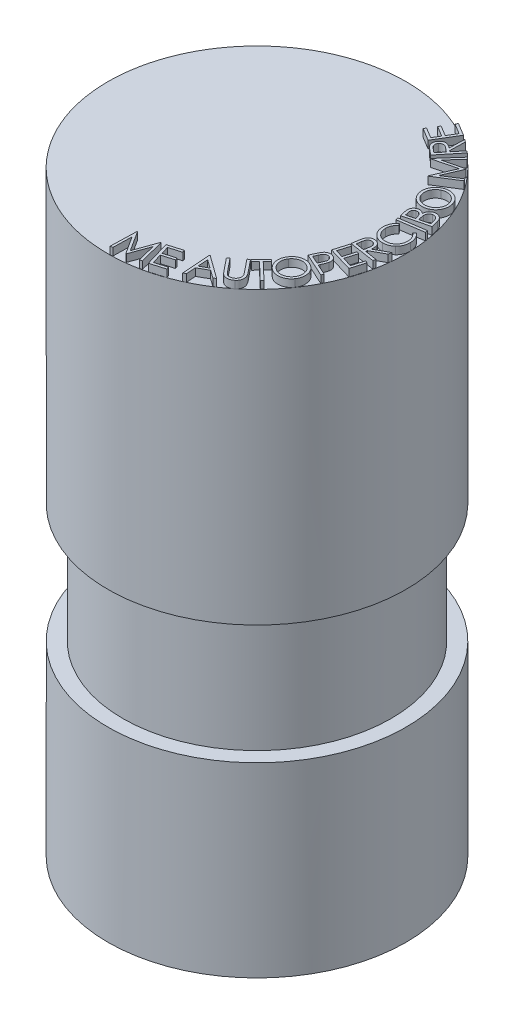
from build123d import *

# Parameters (mm, degrees)
CROQUIS1_R              = 20
SALIENTE_EXTRUIR1_DEPTH = 80
CROQUIS2_W              = 2
CROQUIS2_H              = 16
SALIENTE_EXTRUIR2_DEPTH = 1


with BuildPart() as part:
    # Croquis1 → Saliente-Extruir1 (new body)
    with BuildSketch(Plane(origin=(0, 0, 0), x_dir=(1, 0, 0), z_dir=(0, 1, 0))):
        with Locations(Location((0, 0, 0), (0, 0, 270))):
            Circle(CROQUIS1_R)
    extrude(amount=SALIENTE_EXTRUIR1_DEPTH)

    # Croquis2 → Cortar-Revolución1 (revolve, cut)
    with BuildSketch(Plane(origin=(0, 0, 0), x_dir=(0, 0, -1), z_dir=(1, 0, 0))):
        with Locations((19, 33)):
            Rectangle(CROQUIS2_W, CROQUIS2_H)
    revolve(axis=Axis((0, -3.31019037, 0), (0, 1, 0)), mode=Mode.SUBTRACT)

    # Croquis3 → Saliente-Extruir2 (add)
    # profile 1 of 16: a face of its own
    with BuildSketch(Plane(origin=(0, 80, 0), x_dir=(1, 0, 0), z_dir=(0, 1, 0))):
        Polygon((0.262920673, -19.970552885), (0.365284455, -16.467047276), (0.422075321, -16.460737179), (2.141225962, -19.13271234), (3.211838942, -16.147335737), (3.267928686, -16.141726763), (4.149238782, -19.534455128), (3.809895833, -19.573016827), (3.195713141, -17.144330929), (2.252704327, -19.747596154), (2.166466346, -19.757411859), (0.652043269, -17.410757212), (0.595252404, -19.933393429), align=None)
    # profile 2 of 16: a face of its own
    with BuildSketch(Plane(origin=(0, 80, 0), x_dir=(1, 0, 0), z_dir=(0, 1, 0))):
        Polygon((3.827170639, -16.036394888), (5.748244357, -15.4705896), (5.845700286, -15.800817965), (4.259762786, -16.26776508), (4.568256376, -17.315942164), (6.14017144, -16.853201779), (6.236926248, -17.181326779), (4.665011183, -17.644067164), (5.052030414, -18.959371651), (6.623945478, -18.496631266), (6.721401408, -18.826859632), (4.814350126, -19.388458189), align=None)
    # profile 3 of 16: a face of its own
    with BuildSketch(Plane(origin=(0, 80, 0), x_dir=(1, 0, 0), z_dir=(0, 1, 0))):
        Polygon((8.05795711, -14.338696455), (11.163926661, -16.578780589), (10.838606148, -16.760371134), (9.805853744, -16.029101102), (8.499663841, -16.759670012), (8.583798456, -18.020988121), (8.245857751, -18.210291006), (7.984339321, -14.380062641), align=None)
        Polygon((8.379772014, -15.001957673), (8.472320091, -16.390879948), (9.508578103, -15.811753346), align=None, mode=Mode.SUBTRACT)
    # profile 4 of 16: a face of its own
    with BuildSketch(Plane(origin=(0, 80, 0), x_dir=(1, 0, 0), z_dir=(0, 1, 0))):
        with BuildLine():
            Line((9.42995308, -13.537753655), (9.700586092, -13.319704777))
            Line((9.700586092, -13.319704777), (11.019396189, -14.954019681))
            add(Edge.make_bspline(
                [(11.019396189, -14.954019681), (11.038159707, -14.976868058), (11.073902476, -15.020392105), (11.123762411, -15.083221771), (11.170337216, -15.13751021), (11.210924398, -15.185252117), (11.246010621, -15.226094636), (11.275827607, -15.259841043), (11.301335022, -15.286034267), (11.316870923, -15.300876915), (11.323683048, -15.307385065)],
                knots=[0, 0, 0, 0, 1.520764006, 2.89691493, 4.125196125, 5.199597565, 6.120141528, 6.894832544, 7.515410236, 8, 8, 8, 8], degree=3))
            add(Edge.make_bspline(
                [(11.323683048, -15.307385065), (11.348145641, -15.330022997), (11.395572374, -15.373912175), (11.47360989, -15.426858554), (11.551665552, -15.469926532), (11.632461, -15.50088692), (11.717494301, -15.519580087), (11.808202244, -15.524508735), (11.904960273, -15.517984613), (12.005729612, -15.498856411), (12.10630543, -15.469346372), (12.2020613, -15.430114767), (12.290967908, -15.381625007), (12.344473927, -15.341913808), (12.371159009, -15.322108623)],
                knots=[0, 0, 0, 0, 1.040137847, 2.016562117, 2.938047741, 3.821020636, 4.710583084, 5.647195567, 6.649867989, 7.734190427, 8.845716221, 9.919833567, 10.962557647, 12, 12, 12, 12], degree=3))
            add(Edge.make_bspline(
                [(12.371159009, -15.322108623), (12.392580067, -15.303353448), (12.435304089, -15.265946495), (12.492428473, -15.20254751), (12.541542072, -15.132589626), (12.583500775, -15.057612739), (12.617878792, -14.979088783), (12.642504889, -14.89813592), (12.657604376, -14.815794364), (12.662144982, -14.732014213), (12.658151214, -14.646869971), (12.643737994, -14.560873308), (12.620031394, -14.4740373), (12.596836743, -14.417675418), (12.585001157, -14.388915514)],
                knots=[0, 0, 0, 0, 0.992167313, 1.978864769, 2.966907326, 3.966575884, 4.970255265, 5.949826752, 6.910471341, 7.881873917, 8.869109633, 9.876553196, 10.916464007, 12, 12, 12, 12], degree=3))
            add(Edge.make_bspline(
                [(12.585001157, -14.388915514), (12.579576344, -14.377365952), (12.5674671, -14.351585066), (12.543058691, -14.31164806), (12.5136777, -14.264773571), (12.476760164, -14.212789316), (12.435152023, -14.15344533), (12.385471174, -14.089489391), (12.331031305, -14.018118888), (12.291591925, -13.969311683), (12.270898592, -13.943703174)],
                knots=[0, 0, 0, 0, 0.560616297, 1.251405465, 2.055212887, 2.992931923, 4.053585124, 5.241388444, 6.552592194, 8, 8, 8, 8], degree=3))
            Line((12.270898592, -13.943703174), (10.952088496, -12.30938827))
            Line((10.952088496, -12.30938827), (11.222721509, -12.091339392))
            Line((11.222721509, -12.091339392), (12.541531605, -13.725654296))
            add(Edge.make_bspline(
                [(12.541531605, -13.725654296), (12.565035468, -13.755230662), (12.611077029, -13.813167609), (12.676175615, -13.89966472), (12.735256924, -13.984129862), (12.788684266, -14.065778258), (12.835439373, -14.145475432), (12.878176413, -14.221604179), (12.913673412, -14.296065495), (12.944395839, -14.368152497), (12.969729102, -14.439809045), (12.98764187, -14.512912479), (13.000365668, -14.587650371), (13.007564033, -14.66429813), (13.007879188, -14.742819455), (13.003244852, -14.822994707), (12.991509349, -14.904659411), (12.975091255, -14.987461368), (12.952288697, -15.069961793), (12.921931476, -15.15016344), (12.884869225, -15.227498098), (12.840007295, -15.301532657), (12.789129133, -15.373189274), (12.730292485, -15.441038038), (12.665797021, -15.507123636), (12.617859838, -15.547110327), (12.593414618, -15.567501251)],
                knots=[0, 0, 0, 0, 1.29683383, 2.540359156, 3.715520012, 4.834829386, 5.888774922, 6.886986131, 7.830707756, 8.718771528, 9.576342449, 10.436386598, 11.298971503, 12.17712305, 13.075706197, 13.992021582, 14.931470865, 15.90540027, 16.888407425, 17.865899033, 18.845495464, 19.82788039, 20.834183252, 21.858395803, 22.907904428, 24, 24, 24, 24], degree=3))
            add(Edge.make_bspline(
                [(12.593414618, -15.567501251), (12.566386086, -15.588736984), (12.513196575, -15.630526831), (12.428971058, -15.684937599), (12.344579498, -15.733610082), (12.258814361, -15.7745233), (12.17187381, -15.807385351), (12.084459266, -15.834486678), (11.99548363, -15.853233045), (11.906196421, -15.865445996), (11.817544039, -15.869119491), (11.730759792, -15.867678511), (11.646327168, -15.857543634), (11.563977352, -15.840771572), (11.483739774, -15.816812531), (11.405830234, -15.785925167), (11.330188487, -15.748003647), (11.282530393, -15.717507278), (11.258478721, -15.702116636)],
                knots=[0, 0, 0, 0, 1.144700711, 2.252659125, 3.337304626, 4.389199177, 5.41453013, 6.431875958, 7.43529886, 8.440774248, 9.430813523, 10.388887005, 11.329652752, 12.259690246, 13.186036776, 14.115813444, 15.049105103, 16, 16, 16, 16], degree=3))
            add(Edge.make_bspline(
                [(11.258478721, -15.702116636), (11.242950346, -15.690803387), (11.209305561, -15.666291368), (11.157304993, -15.623537749), (11.101583066, -15.570165997), (11.039852371, -15.508908952), (10.97411828, -15.437644107), (10.903126286, -15.357410217), (10.827097691, -15.268164165), (10.775517272, -15.204888716), (10.748763176, -15.172068559)],
                knots=[0, 0, 0, 0, 0.625227113, 1.354657644, 2.188729345, 3.135311938, 4.184757943, 5.343206505, 6.621955598, 8, 8, 8, 8], degree=3))
            Line((10.748763176, -15.172068559), (9.42995308, -13.537753655))
        make_face()
    # profile 5 of 16: a face of its own
    with BuildSketch(Plane(origin=(0, 80, 0), x_dir=(1, 0, 0), z_dir=(0, 1, 0))):
        Polygon((11.536868452, -12.303090141), (11.292176946, -12.070317705), (12.606780311, -10.690510013), (12.851471818, -10.923282448), (12.31721701, -11.484179884), (14.58674826, -13.645738378), (14.342056754, -13.902348955), (12.072525504, -11.740790461), align=None)
    # profile 6 of 16: a face of its own
    with BuildSketch(Plane(origin=(0, 80, 0), x_dir=(1, 0, 0), z_dir=(0, 1, 0))):
        with BuildLine():
            add(Edge.make_bspline(
                [(13.419185249, -9.282370366), (13.456923299, -9.229876733), (13.531095506, -9.126703182), (13.658850909, -8.988655319), (13.793737653, -8.864914298), (13.937826486, -8.756949618), (14.091699683, -8.666010529), (14.254515263, -8.591706777), (14.425991079, -8.5321625), (14.604871874, -8.490293047), (14.786462702, -8.464140523), (14.967110246, -8.456121454), (15.144428264, -8.466887398), (15.318746284, -8.494531925), (15.489341032, -8.542359886), (15.656766252, -8.607475408), (15.822194144, -8.689019429), (15.926139648, -8.757482599), (15.978980923, -8.792286231)],
                knots=[0, 0, 0, 0, 1.066033823, 2.095235003, 3.097192567, 4.0837777, 5.060749282, 6.041004147, 7.0326349, 8.051383895, 9.06808662, 10.056351471, 11.029998143, 11.995051255, 12.963520223, 13.947644644, 14.956673755, 16, 16, 16, 16], degree=3))
            add(Edge.make_bspline(
                [(15.978980923, -8.792286231), (16.029780586, -8.829164558), (16.129609434, -8.90163592), (16.264050925, -9.025899378), (16.383925636, -9.158270684), (16.487874866, -9.301279643), (16.576276142, -9.453812631), (16.649914434, -9.615938164), (16.706174891, -9.788021253), (16.748209092, -9.966954546), (16.773099239, -10.148890559), (16.781435518, -10.329678285), (16.770719651, -10.506804017), (16.742715879, -10.680741421), (16.695978933, -10.850979584), (16.631763822, -11.017984787), (16.549667464, -11.181591561), (16.482247574, -11.284918859), (16.448031403, -11.337358346)],
                knots=[0, 0, 0, 0, 1.044747507, 2.053083263, 3.042573079, 4.0150113, 4.991740329, 5.974276943, 6.975003363, 8.002267044, 9.031674491, 10.029064489, 11.011701332, 11.98182306, 12.958203001, 13.946382756, 14.957771684, 16, 16, 16, 16], degree=3))
            add(Edge.make_bspline(
                [(16.448031403, -11.337358346), (16.410652834, -11.388600428), (16.337079997, -11.489461039), (16.21185145, -11.625648652), (16.078536548, -11.747485913), (15.934292257, -11.851992364), (15.782066625, -11.942754912), (15.619124052, -12.01550818), (15.447709191, -12.074142098), (15.268630298, -12.115472837), (15.087236916, -12.140690257), (14.907146728, -12.148723508), (14.730757329, -12.138918909), (14.557894921, -12.111852041), (14.389307957, -12.065260836), (14.223902351, -12.003009549), (14.062249795, -11.922038144), (13.960311115, -11.855571287), (13.908568262, -11.821833507)],
                knots=[0, 0, 0, 0, 1.056740191, 2.079998671, 3.078619863, 4.062946356, 5.044616301, 6.028163563, 7.032401823, 8.06072216, 9.087328406, 10.081851471, 11.06138479, 12.028038447, 12.993120206, 13.972258204, 14.970742556, 16, 16, 16, 16], degree=3))
            add(Edge.make_bspline(
                [(13.908568262, -11.821833507), (13.874810711, -11.79773569), (13.807822048, -11.749915853), (13.713933671, -11.670881667), (13.625693541, -11.587449267), (13.544718841, -11.497990419), (13.468546102, -11.404787847), (13.398817704, -11.306253662), (13.336029964, -11.202466355), (13.279127059, -11.09463538), (13.229682567, -10.983548454), (13.187224663, -10.870608298), (13.153805274, -10.756132899), (13.127596051, -10.640720851), (13.109435598, -10.524062396), (13.098656998, -10.406031554), (13.096849474, -10.28678247), (13.102397211, -10.167119498), (13.11560468, -10.048116597), (13.136787604, -9.931081735), (13.164780846, -9.816242106), (13.200506658, -9.703982057), (13.244217601, -9.594509065), (13.294906749, -9.487436962), (13.352876463, -9.382880724), (13.39700922, -9.315984624), (13.419185249, -9.282370366)],
                knots=[0, 0, 0, 0, 1.037498041, 2.058816626, 3.068109967, 4.073992118, 5.075922538, 6.078671835, 7.091651888, 8.10922995, 9.127563933, 10.132357503, 11.126062036, 12.109248317, 13.091860485, 14.078241757, 15.072565591, 16.073676463, 17.074035494, 18.066293485, 19.047808686, 20.02988123, 21.011588053, 21.995174276, 22.992605997, 24, 24, 24, 24], degree=3))
        make_face()
        with BuildLine():
            add(Edge.make_bspline(
                [(13.708748551, -9.462558667), (13.691086724, -9.48920686), (13.655850172, -9.542371825), (13.609776074, -9.625845983), (13.56966968, -9.711877072), (13.535036595, -9.800274979), (13.507279398, -9.891581008), (13.484694781, -9.985209655), (13.467815279, -10.081188632), (13.457339819, -10.179106501), (13.453451737, -10.277453825), (13.454349381, -10.375361188), (13.462928883, -10.471873937), (13.477869921, -10.566875968), (13.498070129, -10.660397772), (13.524755221, -10.752793361), (13.558597444, -10.843452885), (13.59773897, -10.932868991), (13.643163765, -11.019187967), (13.693806674, -11.102444335), (13.750065376, -11.181834854), (13.811929143, -11.257697856), (13.879367654, -11.330100973), (13.952520657, -11.398557102), (14.030140946, -11.464409854), (14.085879589, -11.503923889), (14.113996948, -11.523856744)],
                knots=[0, 0, 0, 0, 0.984861511, 1.964865996, 2.934655727, 3.908288549, 4.887843072, 5.873020514, 6.874696165, 7.888722766, 8.905099493, 9.906257215, 10.90385989, 11.887799357, 12.868147791, 13.850478198, 14.848496714, 15.848099037, 16.85638069, 17.851901554, 18.849010193, 19.852315574, 20.866342176, 21.895473077, 22.938371391, 24, 24, 24, 24], degree=3))
            add(Edge.make_bspline(
                [(14.113996948, -11.523856744), (14.156509771, -11.551557934), (14.240292826, -11.606150648), (14.372836283, -11.672777011), (14.50782276, -11.725081381), (14.645787776, -11.762492253), (14.786239688, -11.785776529), (14.929357289, -11.794214291), (15.074924275, -11.787442672), (15.221346973, -11.767236054), (15.365584582, -11.73409461), (15.503566203, -11.687577206), (15.633813726, -11.629403907), (15.756111172, -11.558843226), (15.870098042, -11.475597221), (15.976252852, -11.380313424), (16.075343163, -11.273747425), (16.13285176, -11.194497279), (16.161973711, -11.154365558)],
                knots=[0, 0, 0, 0, 1.050689643, 2.070669118, 3.067053792, 4.045557722, 5.027112176, 6.011814862, 7.010280029, 8.041610168, 9.070561698, 10.072016587, 11.053869601, 12.021469533, 12.991960988, 13.972762666, 14.973421169, 16, 16, 16, 16], degree=3))
            add(Edge.make_bspline(
                [(16.161973711, -11.154365558), (16.180595142, -11.126565127), (16.217566024, -11.071370313), (16.265777523, -10.984757448), (16.308123806, -10.896307421), (16.343594247, -10.80567831), (16.374167021, -10.713612803), (16.397971707, -10.619405702), (16.415444619, -10.523362626), (16.426722377, -10.425924994), (16.431266918, -10.328273118), (16.431153089, -10.231297394), (16.423043636, -10.135516098), (16.409281738, -10.041074337), (16.388561779, -9.947931341), (16.362425589, -9.856064354), (16.327876536, -9.766135339), (16.289347963, -9.67715885), (16.243460867, -9.591309384), (16.193081335, -9.508145211), (16.13673841, -9.428817841), (16.075164946, -9.352917839), (16.00742966, -9.281490126), (15.935055343, -9.213150084), (15.857242889, -9.148575284), (15.802070535, -9.108876404), (15.774253358, -9.08886075)],
                knots=[0, 0, 0, 0, 1.027401871, 2.039797731, 3.041601939, 4.037369729, 5.027116348, 6.019514706, 7.019207737, 8.023606199, 9.029849947, 10.020507277, 10.999969789, 11.979642722, 12.949801477, 13.92894827, 14.910276701, 15.906639435, 16.905301003, 17.897595505, 18.891472635, 19.891526426, 20.897027342, 21.912675561, 22.947598428, 24, 24, 24, 24], degree=3))
            add(Edge.make_bspline(
                [(15.774253358, -9.08886075), (15.745682272, -9.070123231), (15.689184433, -9.03307076), (15.602098493, -8.982751552), (15.512820817, -8.940167688), (15.42241314, -8.903699831), (15.330690952, -8.873178097), (15.237630869, -8.849546639), (15.143040375, -8.831761565), (15.047447674, -8.820780278), (14.951427584, -8.815592121), (14.855827344, -8.817839363), (14.761063022, -8.826569004), (14.666433393, -8.839986171), (14.572981229, -8.862305347), (14.479772128, -8.88972994), (14.387212574, -8.923021306), (14.296631247, -8.964187819), (14.2079002, -9.008920413), (14.12337052, -9.059965816), (14.043021495, -9.115132177), (13.966504974, -9.174643543), (13.896313443, -9.240625004), (13.828086933, -9.308936523), (13.765908456, -9.383551606), (13.727847223, -9.436160269), (13.708748551, -9.462558667)],
                knots=[0, 0, 0, 0, 1.053086625, 2.082424138, 3.097368164, 4.099318518, 5.085713582, 6.074630728, 7.056596563, 8.050225357, 9.038433819, 10.018389377, 10.994737269, 11.970739613, 12.961544107, 13.9530816, 14.964901847, 15.990375306, 17.018123497, 18.026244206, 19.031323198, 20.021394151, 21.010442479, 21.998703453, 22.995773306, 24, 24, 24, 24], degree=3))
        make_face(mode=Mode.SUBTRACT)
    # profile 7 of 16: a face of its own
    with BuildSketch(Plane(origin=(0, 80, 0), x_dir=(1, 0, 0), z_dir=(0, 1, 0))):
        with BuildLine():
            Line((14.581204518, -7.746627886), (14.866561089, -7.117721636))
            add(Edge.make_bspline(
                [(14.866561089, -7.117721636), (14.886305149, -7.074429841), (14.924094456, -6.991571154), (14.980140308, -6.873742398), (15.032838212, -6.767678881), (15.081597743, -6.673070337), (15.127253113, -6.590105522), (15.169071397, -6.518642568), (15.207142565, -6.458585507), (15.233282407, -6.423938572), (15.245166858, -6.408186379)],
                knots=[0, 0, 0, 0, 1.417480591, 2.712998655, 3.886848993, 4.945604602, 5.883557876, 6.70747002, 7.412352614, 8, 8, 8, 8], degree=3))
            add(Edge.make_bspline(
                [(15.245166858, -6.408186379), (15.261237433, -6.388764837), (15.293012891, -6.3503637), (15.345246437, -6.297808848), (15.399794071, -6.249868689), (15.457801938, -6.207490507), (15.518871512, -6.170375353), (15.582883338, -6.138068349), (15.64956931, -6.110484973), (15.719075434, -6.088959801), (15.790467852, -6.072502888), (15.863532493, -6.063415625), (15.937442161, -6.061612912), (16.012381098, -6.06539251), (16.088024983, -6.07792694), (16.164750238, -6.096051456), (16.242199141, -6.121290195), (16.292807017, -6.143213549), (16.318584326, -6.154380289)],
                knots=[0, 0, 0, 0, 1.010920213, 1.998836468, 2.969107937, 3.9218231, 4.877026618, 5.833104126, 6.796008065, 7.768722977, 8.749135282, 9.731876362, 10.716806824, 11.71230294, 12.737429626, 13.788137597, 14.873379737, 16, 16, 16, 16], degree=3))
            add(Edge.make_bspline(
                [(16.318584326, -6.154380289), (16.343967505, -6.166713743), (16.39365232, -6.190855137), (16.464593536, -6.231369021), (16.528615329, -6.277354165), (16.5882951, -6.32539082), (16.64065572, -6.37822921), (16.687799065, -6.434359104), (16.728878589, -6.49425072), (16.763954028, -6.557790227), (16.793770876, -6.623769392), (16.816462017, -6.692537338), (16.834407955, -6.762977362), (16.845618819, -6.835751131), (16.850264444, -6.910588466), (16.849434237, -6.987421151), (16.843481801, -7.066244273), (16.834349094, -7.118948901), (16.829702114, -7.145766507)],
                knots=[0, 0, 0, 0, 1.115046619, 2.182582538, 3.222809154, 4.226656976, 5.20612559, 6.156742927, 7.11983726, 8.070589146, 9.021341033, 9.976254562, 10.928126958, 11.890689879, 12.880895564, 13.887500457, 14.925100441, 16, 16, 16, 16], degree=3))
            add(Edge.make_bspline(
                [(16.829702114, -7.145766507), (16.825111889, -7.167582683), (16.815098551, -7.215173539), (16.791415416, -7.29075722), (16.763076136, -7.377692318), (16.726875188, -7.475281132), (16.683827198, -7.583762164), (16.635176487, -7.703815801), (16.577776154, -7.834014482), (16.53737282, -7.924497194), (16.516300672, -7.971687982)],
                knots=[0, 0, 0, 0, 0.604381419, 1.31842669, 2.146331655, 3.084907232, 4.140823189, 5.312120864, 6.598150621, 8, 8, 8, 8], degree=3))
            Line((16.516300672, -7.971687982), (16.41393689, -8.1974492))
            Line((16.41393689, -8.1974492), (17.88278705, -8.863514905))
            Line((17.88278705, -8.863514905), (17.739758204, -9.179019712))
            Line((17.739758204, -9.179019712), (14.581204518, -7.746627886))
        make_face()
        with BuildLine():
            Line((15.03132471, -7.569945193), (16.104742178, -8.057224841))
            Line((16.104742178, -8.057224841), (16.353640415, -7.525073398))
            add(Edge.make_bspline(
                [(16.353640415, -7.525073398), (16.365174083, -7.498934195), (16.387535678, -7.448255235), (16.418531208, -7.374391063), (16.444629516, -7.304654387), (16.46607361, -7.239795397), (16.484505031, -7.179725131), (16.496463827, -7.123766063), (16.506411198, -7.072692338), (16.51162159, -7.011043655), (16.511104722, -6.938293628), (16.496077871, -6.854511441), (16.468264312, -6.77483692), (16.428247646, -6.699913025), (16.377228081, -6.631536493), (16.316992923, -6.571398766), (16.248320458, -6.519692426), (16.196819698, -6.494105842), (16.170647627, -6.481103046)],
                knots=[0, 0, 0, 0, 1.134901202, 2.200358277, 3.181511156, 4.091574853, 4.914091932, 5.675336048, 6.363691037, 6.97892636, 8.130225722, 9.242886839, 10.343868195, 11.469351916, 12.603797396, 13.719745554, 14.841201938, 16, 16, 16, 16], degree=3))
            add(Edge.make_bspline(
                [(16.170647627, -6.481103046), (16.14404955, -6.47019593), (16.091744394, -6.448747072), (16.008778175, -6.43156871), (15.924735819, -6.425562346), (15.840523371, -6.433075928), (15.758324688, -6.450640013), (15.681589895, -6.481150937), (15.610793609, -6.522301047), (15.557594086, -6.566695975), (15.517890992, -6.609552368), (15.486767025, -6.64796936), (15.454658804, -6.692509934), (15.422706586, -6.744258064), (15.388944871, -6.801584046), (15.354546834, -6.86565525), (15.319824222, -6.936202085), (15.296945375, -6.98562781), (15.2851308, -7.011151123)],
                knots=[0, 0, 0, 0, 1.169174063, 2.299182448, 3.434954177, 4.591141998, 5.732489077, 6.848324606, 7.940960212, 9.056592547, 9.65622691, 10.319550302, 11.07010205, 11.891771742, 12.796588618, 13.780806392, 14.854014326, 16, 16, 16, 16], degree=3))
            Line((15.2851308, -7.011151123), (15.03132471, -7.569945193))
        make_face(mode=Mode.SUBTRACT)
    # profile 8 of 16: a face of its own
    with BuildSketch(Plane(origin=(0, 80, 0), x_dir=(1, 0, 0), z_dir=(0, 1, 0))):
        Polygon((15.555842258, -5.552715904), (16.122348669, -3.649871353), (16.449772547, -3.747327282), (15.98212431, -5.317840103), (17.020485688, -5.627034814), (17.483927194, -4.07054443), (17.808546585, -4.167299237), (17.345105079, -5.723789622), (18.647088252, -6.112211096), (19.110529758, -4.555720712), (19.437953637, -4.653176641), (18.875653957, -6.541998756), align=None)
    # profile 9 of 16: a face of its own
    with BuildSketch(Plane(origin=(0, 80, 0), x_dir=(1, 0, 0), z_dir=(0, 1, 0))):
        with BuildLine():
            Line((16.115229752, -3.495473808), (16.218995777, -2.808374449))
            add(Edge.make_bspline(
                [(16.218995777, -2.808374449), (16.2261775, -2.762557773), (16.239963563, -2.674607903), (16.26075061, -2.548550568), (16.281619336, -2.434211487), (16.302828372, -2.33191783), (16.322691139, -2.241276208), (16.343230005, -2.162834039), (16.362248094, -2.095655053), (16.376998348, -2.055531737), (16.383759399, -2.037140475)],
                knots=[0, 0, 0, 0, 1.409254161, 2.705209782, 3.882244946, 4.940769524, 5.879765154, 6.70139688, 7.404761276, 8, 8, 8, 8], degree=3))
            add(Edge.make_bspline(
                [(16.383759399, -2.037140475), (16.393897521, -2.012894905), (16.413840489, -1.965200807), (16.449965913, -1.897404333), (16.490748289, -1.834244903), (16.535733765, -1.775148558), (16.584996248, -1.720066723), (16.63895447, -1.669612402), (16.697560215, -1.623907901), (16.75990588, -1.582660604), (16.825387825, -1.545905286), (16.894623572, -1.516508463), (16.966216242, -1.493419457), (17.040056629, -1.476322635), (17.116399389, -1.466697513), (17.194928886, -1.463358737), (17.276125118, -1.465781092), (17.330553856, -1.473173297), (17.358318694, -1.476944161)],
                knots=[0, 0, 0, 0, 1.03293779, 2.031919065, 3.015866321, 3.986331843, 4.949459806, 5.918226919, 6.887037618, 7.868320558, 8.85552394, 9.835342727, 10.820533722, 11.810342825, 12.811140009, 13.841417219, 14.898877644, 16, 16, 16, 16], degree=3))
            add(Edge.make_bspline(
                [(17.358318694, -1.476944161), (17.403745086, -1.48525496), (17.492426955, -1.501479387), (17.617519453, -1.546739047), (17.732261291, -1.605794858), (17.834599895, -1.681139843), (17.924453085, -1.769952501), (17.999585008, -1.871726157), (18.058120459, -1.986569952), (18.093940034, -2.091056588), (18.115460635, -2.181235881), (18.126113455, -2.255427613), (18.133943239, -2.334484803), (18.137466501, -2.4189903), (18.135753135, -2.508845286), (18.129804297, -2.603982614), (18.121162589, -2.704643487), (18.111427026, -2.773124088), (18.106415649, -2.808374449)],
                knots=[0, 0, 0, 0, 1.274623687, 2.488333414, 3.661461292, 4.830812232, 5.986521774, 7.141635342, 8.31178901, 9.535549023, 10.185841612, 10.871982946, 11.605425733, 12.381311337, 13.208306103, 14.088399513, 15.016004448, 16, 16, 16, 16], degree=3))
            Line((18.106415649, -2.808374449), (19.897781835, -1.810678135))
            Line((19.897781835, -1.810678135), (19.83327863, -2.237661308))
            Line((19.83327863, -2.237661308), (18.042613566, -3.232553135))
            Line((18.042613566, -3.232553135), (18.012465328, -3.429568359))
            Line((18.012465328, -3.429568359), (19.615930873, -3.6721565))
            Line((19.615930873, -3.6721565), (19.564047861, -4.017108423))
            Line((19.564047861, -4.017108423), (16.115229752, -3.495473808))
        make_face()
        with BuildLine():
            Line((16.505053469, -3.201703776), (17.677329111, -3.37908759))
            Line((17.677329111, -3.37908759), (17.771279431, -2.786639673))
            add(Edge.make_bspline(
                [(17.771279431, -2.786639673), (17.77508097, -2.758837916), (17.782420878, -2.705159033), (17.792054269, -2.627175826), (17.797475929, -2.554171358), (17.800460592, -2.486354152), (17.800472952, -2.423902117), (17.798131225, -2.366723811), (17.791531994, -2.315054694), (17.780890825, -2.253470489), (17.758708829, -2.183335066), (17.722421476, -2.105476841), (17.673177577, -2.036041758), (17.613384393, -1.97528698), (17.545664617, -1.923464715), (17.471077293, -1.882228415), (17.39017078, -1.852217229), (17.333285244, -1.841416001), (17.304332316, -1.83591852)],
                knots=[0, 0, 0, 0, 1.115543064, 2.153860413, 3.122948687, 4.024913449, 4.851786614, 5.605251144, 6.297829778, 6.921069533, 8.087747424, 9.209771324, 10.323300771, 11.45333526, 12.586839922, 13.701299183, 14.830034385, 16, 16, 16, 16], degree=3))
            add(Edge.make_bspline(
                [(17.304332316, -1.83591852), (17.275863083, -1.83277254), (17.219437481, -1.826537254), (17.134607889, -1.831450527), (17.052300054, -1.85032107), (16.973511671, -1.8803454), (16.900305825, -1.920389938), (16.835336698, -1.970585359), (16.778633408, -2.028864753), (16.739452483, -2.08600143), (16.712706267, -2.138091936), (16.693265417, -2.183851229), (16.674123989, -2.235911134), (16.657006985, -2.295082312), (16.640187016, -2.360506666), (16.624921778, -2.432616428), (16.610147624, -2.511156768), (16.601434455, -2.565995917), (16.596900425, -2.594532302)],
                knots=[0, 0, 0, 0, 1.160188431, 2.299476486, 3.426197678, 4.572129098, 5.709049224, 6.79719938, 7.889798381, 8.993969985, 9.59168263, 10.262478167, 11.009073965, 11.839734411, 12.759242613, 13.748225336, 14.828254854, 16, 16, 16, 16], degree=3))
            Line((16.596900425, -2.594532302), (16.505053469, -3.201703776))
        make_face(mode=Mode.SUBTRACT)
    # profile 10 of 16: a face of its own
    with BuildSketch(Plane(origin=(0, 80, 0), x_dir=(1, 0, 0), z_dir=(0, 1, 0))):
        with BuildLine():
            Line((17.024030638, 2.071751294), (17.240677273, 1.801118281))
            add(Edge.make_bspline(
                [(17.240677273, 1.801118281), (17.217075648, 1.781516188), (17.170195233, 1.742580129), (17.104365529, 1.67987894), (17.042507626, 1.614850276), (16.98558224, 1.54671163), (16.93362199, 1.475583902), (16.88587795, 1.401843786), (16.842255057, 1.325456198), (16.803717801, 1.246240136), (16.770438439, 1.164768653), (16.740151753, 1.081843899), (16.717189692, 0.996457102), (16.696910319, 0.909605442), (16.682389991, 0.820815436), (16.67285972, 0.729985175), (16.666570497, 0.637340901), (16.667427728, 0.574865724), (16.667860766, 0.543305781)],
                knots=[0, 0, 0, 0, 1.026452541, 2.038864796, 3.040220736, 4.028572898, 5.00781649, 5.986185198, 6.966926773, 7.949817699, 8.931650112, 9.911237193, 10.901753069, 11.888339846, 12.895087237, 13.909913306, 14.944172359, 16, 16, 16, 16], degree=3))
            add(Edge.make_bspline(
                [(16.667860766, 0.543305781), (16.669356324, 0.508927742), (16.672323757, 0.440716081), (16.68333486, 0.33942942), (16.701987145, 0.240514155), (16.725747906, 0.143271945), (16.755652165, 0.048047886), (16.792792873, -0.044802342), (16.834209549, -0.136248159), (16.88369644, -0.224019307), (16.937257058, -0.3087168), (16.995678735, -0.38871082), (17.057784927, -0.464287794), (17.125812531, -0.533066161), (17.19556938, -0.599212204), (17.270851315, -0.658703046), (17.350672608, -0.712608343), (17.433532511, -0.762710391), (17.52064557, -0.805648535), (17.609824175, -0.8440243), (17.701763786, -0.875385591), (17.796119723, -0.900874268), (17.893186745, -0.919553089), (17.992644224, -0.932959528), (18.09453367, -0.940210995), (18.16310971, -0.939782836), (18.197708523, -0.939566815)],
                knots=[0, 0, 0, 0, 1.042060651, 2.067619036, 3.082495894, 4.088521804, 5.098151993, 6.102383385, 7.115852252, 8.136120684, 9.151318389, 10.149469464, 11.134610231, 12.110733093, 13.077365288, 14.044645177, 15.012546446, 15.993405745, 16.974724667, 17.95156587, 18.932016435, 19.914151932, 20.909488052, 21.923574699, 22.952376794, 24, 24, 24, 24], degree=3))
            add(Edge.make_bspline(
                [(18.197708523, -0.939566815), (18.249688228, -0.937075608), (18.351826162, -0.932180491), (18.501319145, -0.907547953), (18.644211456, -0.871098393), (18.779585397, -0.81893077), (18.908815392, -0.755328275), (19.030770228, -0.676878155), (19.145106151, -0.584398304), (19.252061826, -0.480322423), (19.34898164, -0.366116124), (19.433539232, -0.243873635), (19.504136339, -0.114569708), (19.561180689, 0.021469119), (19.604707479, 0.164554026), (19.634858139, 0.314546167), (19.651205292, 0.471415832), (19.651158037, 0.578092142), (19.651134004, 0.632348249)],
                knots=[0, 0, 0, 0, 1.042487182, 2.048443468, 3.031421471, 3.99380648, 4.951355209, 5.914390058, 6.89414708, 7.894742896, 8.901974913, 9.892272652, 10.86932618, 11.84997898, 12.844446273, 13.862527526, 14.912870772, 16, 16, 16, 16], degree=3))
            add(Edge.make_bspline(
                [(19.651134004, 0.632348249), (19.648289537, 0.692080152), (19.64268627, 0.809744993), (19.610908743, 0.981612324), (19.562309941, 1.145682082), (19.496424118, 1.302233167), (19.411290351, 1.450319913), (19.309024057, 1.590372173), (19.189013994, 1.722900187), (19.097657094, 1.802042679), (19.050973747, 1.842484467)],
                knots=[0, 0, 0, 0, 1.026850056, 2.022774128, 2.995030449, 3.963420593, 4.934971343, 5.924018538, 6.939174142, 8, 8, 8, 8], degree=3))
            Line((19.050973747, 1.842484467), (19.252896824, 2.121530941))
            add(Edge.make_bspline(
                [(19.252896824, 2.121530941), (19.28053359, 2.100151213), (19.335535456, 2.057601917), (19.41265332, 1.987597172), (19.485480183, 1.914150405), (19.554087051, 1.836800704), (19.61703791, 1.754440651), (19.675767211, 1.668164013), (19.731067177, 1.578249703), (19.780219965, 1.48375989), (19.825475835, 1.386184495), (19.864807542, 1.285326163), (19.897416844, 1.181121225), (19.925723336, 1.074533429), (19.948173384, 0.964743354), (19.964828527, 0.851922834), (19.976318164, 0.736093205), (19.979203746, 0.657847543), (19.980661247, 0.618325813)],
                knots=[0, 0, 0, 0, 0.968995634, 1.928466184, 2.886621551, 3.837466681, 4.794480758, 5.760152212, 6.731963377, 7.720881962, 8.713004475, 9.714719251, 10.721477739, 11.740499166, 12.772961701, 13.828315383, 14.903086391, 16, 16, 16, 16], degree=3))
            add(Edge.make_bspline(
                [(19.980661247, 0.618325813), (19.980931586, 0.580698668), (19.981464062, 0.506585966), (19.977583734, 0.396571165), (19.967329692, 0.289733517), (19.95382243, 0.18523113), (19.933810945, 0.084051332), (19.910339548, -0.01438648), (19.881230694, -0.109560756), (19.84776451, -0.202103504), (19.809117926, -0.291638293), (19.766250848, -0.378714571), (19.717850426, -0.462287919), (19.665250238, -0.543661328), (19.606718823, -0.621092983), (19.544546269, -0.696449681), (19.476766949, -0.768243739), (19.428640052, -0.813599987), (19.404339132, -0.836501911)],
                knots=[0, 0, 0, 0, 1.116875539, 2.199865644, 3.265678381, 4.301703491, 5.326167675, 6.325593885, 7.304341921, 8.278704134, 9.245156567, 10.197589888, 11.157848009, 12.11028133, 13.071766491, 14.037247452, 15.008938955, 16, 16, 16, 16], degree=3))
            add(Edge.make_bspline(
                [(19.404339132, -0.836501911), (19.361977987, -0.872838048), (19.277868098, -0.94498502), (19.140884342, -1.038411826), (18.996883659, -1.117787821), (18.845868088, -1.183300364), (18.688147272, -1.235283413), (18.523498619, -1.273878342), (18.351729911, -1.298760319), (18.234715018, -1.304194252), (18.175272625, -1.306954636)],
                knots=[0, 0, 0, 0, 0.995167128, 1.975947448, 2.952009738, 3.924958641, 4.908633156, 5.910946607, 6.93878181, 8, 8, 8, 8], degree=3))
            add(Edge.make_bspline(
                [(18.175272625, -1.306954636), (18.112811623, -1.306793208), (17.98983603, -1.306475382), (17.808781577, -1.284637028), (17.634516928, -1.247241972), (17.467920175, -1.191252477), (17.308011683, -1.11962658), (17.156302095, -1.029644653), (17.010804651, -0.924013757), (16.874783911, -0.801926238), (16.749665483, -0.667586552), (16.639636167, -0.52246235), (16.546039153, -0.368265427), (16.46855284, -0.205469878), (16.407196618, -0.034005158), (16.362583569, 0.146389717), (16.333211857, 0.335565334), (16.327311646, 0.464908144), (16.324311087, 0.530685589)],
                knots=[0, 0, 0, 0, 1.028679874, 2.025304009, 2.999159958, 3.961406688, 4.91645707, 5.881590374, 6.863117077, 7.875192526, 8.889091383, 9.884397207, 10.871305318, 11.856791798, 12.850949195, 13.867347162, 14.915436791, 16, 16, 16, 16], degree=3))
            add(Edge.make_bspline(
                [(16.324311087, 0.530685589), (16.323855845, 0.570890133), (16.32295531, 0.650420542), (16.329553681, 0.768395533), (16.342003791, 0.883578342), (16.361052631, 0.995653414), (16.385611313, 1.10501883), (16.41619929, 1.211436628), (16.453918443, 1.314885708), (16.496171536, 1.415562148), (16.544837308, 1.512654014), (16.598652259, 1.605478745), (16.657071067, 1.694270367), (16.720193027, 1.778855022), (16.789190107, 1.858385729), (16.861935496, 1.934781029), (16.940901629, 2.005410973), (16.996241568, 2.049574489), (17.024030638, 2.071751294)],
                knots=[0, 0, 0, 0, 1.096706797, 2.169444804, 3.221421571, 4.256037762, 5.269232159, 6.278204475, 7.274566423, 8.271723739, 9.255499643, 10.235403907, 11.197450078, 12.153880424, 13.112433815, 14.068438987, 15.030062466, 16, 16, 16, 16], degree=3))
        make_face()
    # profile 11 of 16: a face of its own
    with BuildSketch(Plane(origin=(0, 80, 0), x_dir=(1, 0, 0), z_dir=(0, 1, 0))):
        Polygon((16.349632082, 2.268388953), (16.298450191, 2.613340876), (19.7472683, 3.128665396), (19.798450191, 2.783713472), align=None)
    # profile 12 of 16: a face of its own
    with BuildSketch(Plane(origin=(0, 80, 0), x_dir=(1, 0, 0), z_dir=(0, 1, 0))):
        with BuildLine():
            Line((16.205989672, 3.053352804), (16.039823807, 3.720820753))
            add(Edge.make_bspline(
                [(16.039823807, 3.720820753), (16.03182014, 3.753476002), (16.016275722, 3.816897795), (15.998477848, 3.910107881), (15.983798892, 3.997925666), (15.975184238, 4.080840361), (15.968836458, 4.158680942), (15.968403609, 4.231740038), (15.971335235, 4.299736544), (15.9827935, 4.382689203), (16.006622049, 4.479971297), (16.050948158, 4.589477366), (16.11226955, 4.689691491), (16.187252317, 4.78111831), (16.275426674, 4.860643128), (16.373848253, 4.927030591), (16.481401691, 4.980416484), (16.55868824, 5.002486972), (16.597916755, 5.013689342)],
                knots=[0, 0, 0, 0, 1.00952441, 1.960660237, 2.849137041, 3.682336157, 4.46341537, 5.193377768, 5.875080463, 6.505383298, 7.705472363, 8.873274696, 10.038437685, 11.220161388, 12.412735861, 13.59045102, 14.776979554, 16, 16, 16, 16], degree=3))
            add(Edge.make_bspline(
                [(16.597916755, 5.013689342), (16.634925772, 5.021472), (16.70816054, 5.036872603), (16.81942592, 5.042202457), (16.929066688, 5.032143689), (17.03638512, 5.007524717), (17.140696015, 4.968591177), (17.239180559, 4.912566975), (17.332593828, 4.842298917), (17.387865809, 4.785446028), (17.41612589, 4.756377644)],
                knots=[0, 0, 0, 0, 1.003948746, 1.986649755, 2.94719158, 3.922126885, 4.905063451, 5.895138073, 6.923802518, 8, 8, 8, 8], degree=3))
            add(Edge.make_bspline(
                [(17.41612589, 4.756377644), (17.420881907, 4.801795702), (17.429949474, 4.888387334), (17.452584539, 5.011048749), (17.483897509, 5.119314426), (17.522831845, 5.214996642), (17.570930136, 5.299726204), (17.626329465, 5.377137884), (17.69031224, 5.447874827), (17.761633276, 5.512429932), (17.840516025, 5.569178609), (17.926447217, 5.616228478), (18.017655493, 5.655459236), (18.081948315, 5.673461054), (18.114443198, 5.682559535)],
                knots=[0, 0, 0, 0, 1.314466316, 2.506090953, 3.585608076, 4.553994771, 5.47286937, 6.38410005, 7.289324166, 8.213553529, 9.149029755, 10.079653893, 11.029418526, 12, 12, 12, 12], degree=3))
            add(Edge.make_bspline(
                [(18.114443198, 5.682559535), (18.147972455, 5.69007311), (18.214071676, 5.704885291), (18.314048795, 5.714106195), (18.412460297, 5.714555863), (18.509339717, 5.703942308), (18.604613225, 5.682904718), (18.697814419, 5.650566185), (18.789940477, 5.609446315), (18.8791364, 5.557335451), (18.964807831, 5.497162486), (19.042821759, 5.426029199), (19.114438937, 5.347604301), (19.179164176, 5.260550207), (19.234633942, 5.164065111), (19.283915886, 5.059756667), (19.326412352, 4.947019137), (19.347905888, 4.867825696), (19.358934384, 4.827190945)],
                knots=[0, 0, 0, 0, 0.973703028, 1.919547819, 2.840942689, 3.761096816, 4.677806272, 5.602248186, 6.554620752, 7.534688434, 8.527960399, 9.518308364, 10.522469503, 11.536688397, 12.588320826, 13.673573324, 14.806292925, 16, 16, 16, 16], degree=3))
            Line((19.358934384, 4.827190945), (19.590304576, 3.897503445))
            Line((19.590304576, 3.897503445), (16.205989672, 3.053352804))
        make_face()
        with BuildLine():
            Line((16.454887909, 3.467715785), (17.538121082, 3.738348797))
            Line((17.538121082, 3.738348797), (17.4904448, 3.931858413))
            add(Edge.make_bspline(
                [(17.4904448, 3.931858413), (17.483147838, 3.960186802), (17.469043611, 4.014942468), (17.445687162, 4.093370311), (17.422718696, 4.165735189), (17.39938968, 4.231778656), (17.373581207, 4.290787266), (17.348823036, 4.343882219), (17.323531811, 4.391017535), (17.288445937, 4.444210661), (17.241068486, 4.502773325), (17.175932274, 4.561546006), (17.103297037, 4.609225724), (17.024295992, 4.645373759), (16.941432802, 4.670024004), (16.856333625, 4.681427222), (16.77026847, 4.679846053), (16.713941511, 4.667797674), (16.68555698, 4.661726201)],
                knots=[0, 0, 0, 0, 1.138848682, 2.201269425, 3.185408855, 4.094959815, 4.926524557, 5.691719251, 6.375791386, 7.006724111, 8.170633088, 9.298083499, 10.408515371, 11.540363316, 12.669024756, 13.761567088, 14.87199896, 16, 16, 16, 16], degree=3))
            add(Edge.make_bspline(
                [(16.68555698, 4.661726201), (16.666726212, 4.656518484), (16.63010143, 4.646389769), (16.578373662, 4.624753228), (16.530646908, 4.599896061), (16.487495235, 4.570297225), (16.449058435, 4.535975781), (16.414899609, 4.49766732), (16.384923293, 4.454884234), (16.359842414, 4.407801714), (16.338948495, 4.35630331), (16.325527772, 4.299521726), (16.316259409, 4.238103581), (16.312786722, 4.171640423), (16.316362394, 4.100213469), (16.323589458, 4.023997707), (16.338325181, 3.942933571), (16.350904034, 3.887638026), (16.35743198, 3.858941746)],
                knots=[0, 0, 0, 0, 0.950431923, 1.848536573, 2.724081896, 3.566846128, 4.388999856, 5.22721919, 6.060635823, 6.926140583, 7.819981768, 8.758347707, 9.759343246, 10.84187855, 11.992094739, 13.23874488, 14.567013873, 16, 16, 16, 16], degree=3))
            Line((16.35743198, 3.858941746), (16.454887909, 3.467715785))
        make_face(mode=Mode.SUBTRACT)
        with BuildLine():
            Line((17.878866275, 3.823184535), (19.175941595, 4.146401682))
            Line((19.175941595, 4.146401682), (19.072175569, 4.564971394))
            add(Edge.make_bspline(
                [(19.072175569, 4.564971394), (19.064304126, 4.594670619), (19.049080432, 4.652110142), (19.02582887, 4.73496726), (19.000199799, 4.810460494), (18.975298197, 4.879754679), (18.948819237, 4.94202145), (18.921163208, 4.997438562), (18.894460239, 5.047086262), (18.856024481, 5.102521094), (18.804695747, 5.163316718), (18.734032531, 5.22447846), (18.655528978, 5.274837447), (18.569814146, 5.3128363), (18.480173213, 5.338854684), (18.389289344, 5.351978774), (18.298043015, 5.350060542), (18.238884911, 5.338047866), (18.20909464, 5.331998637)],
                knots=[0, 0, 0, 0, 1.128089403, 2.181771251, 3.15858402, 4.054406748, 4.88475967, 5.640714153, 6.328273456, 6.951817178, 8.114235268, 9.239449387, 10.370048665, 11.526147578, 12.669406776, 13.787005146, 14.885601231, 16, 16, 16, 16], degree=3))
            add(Edge.make_bspline(
                [(18.20909464, 5.331998637), (18.173079764, 5.321110178), (18.102247, 5.29969515), (18.005074816, 5.245855164), (17.920628908, 5.174450733), (17.849183086, 5.08755612), (17.791048862, 4.98792427), (17.751761507, 4.875763769), (17.725936597, 4.754055328), (17.72414304, 4.669113441), (17.723217236, 4.625267868)],
                knots=[0, 0, 0, 0, 0.969968014, 1.907698192, 2.846205569, 3.810991942, 4.801047322, 5.809526122, 6.869314223, 8, 8, 8, 8], degree=3))
            add(Edge.make_bspline(
                [(17.723217236, 4.625267868), (17.72378457, 4.608668172), (17.725000977, 4.573077156), (17.729949312, 4.515695488), (17.739512762, 4.451033103), (17.751633899, 4.37837929), (17.765836092, 4.298000043), (17.785619537, 4.210150072), (17.806775501, 4.114372564), (17.823313693, 4.048206331), (17.831891114, 4.013889663)],
                knots=[0, 0, 0, 0, 0.640748033, 1.373812758, 2.220507065, 3.161778749, 4.21583139, 5.368895857, 6.635395684, 8, 8, 8, 8], degree=3))
            Line((17.831891114, 4.013889663), (17.878866275, 3.823184535))
        make_face(mode=Mode.SUBTRACT)
    # profile 13 of 16: a face of its own
    with BuildSketch(Plane(origin=(0, 80, 0), x_dir=(1, 0, 0), z_dir=(0, 1, 0))):
        with BuildLine():
            add(Edge.make_bspline(
                [(14.901937758, 6.629261467), (14.876973307, 6.689141024), (14.827892886, 6.806864977), (14.774659684, 6.987990593), (14.739958447, 7.168328439), (14.72362768, 7.348019516), (14.725704311, 7.527042968), (14.746267531, 7.705325833), (14.784985504, 7.882978593), (14.842498617, 8.057702603), (14.915558052, 8.226171713), (15.002344267, 8.384950826), (15.104364376, 8.530946889), (15.219159592, 8.665647675), (15.349684209, 8.786490611), (15.492393312, 8.896533385), (15.649445492, 8.993905316), (15.7619, 9.047538857), (15.819005065, 9.074774288)],
                knots=[0, 0, 0, 0, 1.067532711, 2.098782583, 3.101732561, 4.086935478, 5.064375454, 6.044273926, 7.036776378, 8.052838712, 9.067909637, 10.056465801, 11.026759985, 11.99546585, 12.964653068, 13.949788352, 14.958890371, 16, 16, 16, 16], degree=3))
            add(Edge.make_bspline(
                [(15.819005065, 9.074774288), (15.877033029, 9.098755491), (15.991342452, 9.145996121), (16.167458784, 9.197360087), (16.34392166, 9.229583575), (16.520311413, 9.245006055), (16.696970774, 9.240086646), (16.873756383, 9.218792652), (17.050324798, 9.177154315), (17.225251613, 9.119491658), (17.393868948, 9.045767225), (17.552952491, 8.958955003), (17.699022825, 8.856980314), (17.833136066, 8.742108652), (17.954803847, 8.613265367), (18.063561698, 8.471020676), (18.160557686, 8.315388348), (18.213693848, 8.203840959), (18.240679745, 8.147190153)],
                knots=[0, 0, 0, 0, 1.042979939, 2.054568671, 3.041907714, 4.020236222, 4.991553973, 5.973883715, 6.974495988, 8.001338395, 9.031078437, 10.028942848, 11.008373325, 11.986200527, 12.958853125, 13.94781816, 14.957772509, 16, 16, 16, 16], degree=3))
            add(Edge.make_bspline(
                [(18.240679745, 8.147190153), (18.26528927, 8.088510393), (18.313719061, 7.973032806), (18.364065717, 7.794519993), (18.398576925, 7.617026187), (18.414255766, 7.439374168), (18.410581525, 7.261707042), (18.38835999, 7.084251017), (18.349304503, 6.906735715), (18.290834326, 6.732205759), (18.218004456, 6.563576874), (18.131271603, 6.405137818), (18.030104392, 6.25992412), (17.916748396, 6.126486653), (17.79000527, 6.005286606), (17.649561004, 5.897061389), (17.496346145, 5.800818053), (17.386351131, 5.748510682), (17.330623655, 5.722009865)],
                knots=[0, 0, 0, 0, 1.057910445, 2.081892373, 3.079468352, 4.063153026, 5.043303256, 6.030647572, 7.034509841, 8.062559651, 9.088393286, 10.087431026, 11.062600661, 12.028084475, 12.996242916, 13.974756371, 14.9739379, 16, 16, 16, 16], degree=3))
            add(Edge.make_bspline(
                [(17.330623655, 5.722009865), (17.292229706, 5.705922788), (17.215996041, 5.673980857), (17.099519399, 5.633965391), (16.981981692, 5.602052584), (16.863060423, 5.579368773), (16.743286408, 5.562718859), (16.622370224, 5.555310742), (16.500611236, 5.555278815), (16.378599274, 5.562950328), (16.257507532, 5.578287476), (16.138934729, 5.601288152), (16.023581871, 5.632436201), (15.911189741, 5.670370327), (15.801570303, 5.715043673), (15.695320684, 5.768004633), (15.592322959, 5.828306121), (15.492907381, 5.895673312), (15.397735379, 5.968813519), (15.308659916, 6.048206766), (15.225736138, 6.132715378), (15.148362896, 6.221681321), (15.077523156, 6.31610887), (15.011976446, 6.415108228), (14.952860131, 6.519590181), (14.918979016, 6.592559786), (14.901937758, 6.629261467)],
                knots=[0, 0, 0, 0, 1.038609618, 2.062226491, 3.070931259, 4.075175103, 5.081449092, 6.086623927, 7.095581565, 8.118217715, 9.135300867, 10.139544711, 11.129838861, 12.114691227, 13.098091975, 14.081388955, 15.074649682, 16.074310626, 17.076367477, 18.067794433, 19.049325662, 20.029209459, 21.007842827, 21.99293692, 22.990503119, 24, 24, 24, 24], degree=3))
        make_face()
        with BuildLine():
            add(Edge.make_bspline(
                [(15.206925738, 6.78280714), (15.220580994, 6.753874985), (15.247775817, 6.696255789), (15.295046183, 6.61328165), (15.347729962, 6.533857624), (15.405869759, 6.458216359), (15.469337789, 6.38652758), (15.537517929, 6.318179718), (15.611088857, 6.25379755), (15.689417517, 6.193770696), (15.771313379, 6.138436142), (15.855678863, 6.088679589), (15.942741114, 6.045636348), (16.031612613, 6.008733594), (16.12228227, 5.976785056), (16.21508526, 5.951570792), (16.309955285, 5.932604863), (16.406705146, 5.920030853), (16.504365027, 5.91384018), (16.602285148, 5.913571291), (16.699715568, 5.920805597), (16.796876976, 5.934228411), (16.893945798, 5.953703367), (16.990722337, 5.980774538), (17.087592902, 6.013333824), (17.150829707, 6.040137432), (17.182686956, 6.053640474)],
                knots=[0, 0, 0, 0, 0.983160133, 1.957990931, 2.932318644, 3.910848401, 4.888085115, 5.873578463, 6.876487957, 7.890935376, 8.905128389, 9.912991566, 10.899322473, 11.88795301, 12.869458189, 13.852382071, 14.841430148, 15.841221447, 16.849059021, 17.847636495, 18.84879481, 19.849540638, 20.861135046, 21.889427734, 22.93674216, 24, 24, 24, 24], degree=3))
            add(Edge.make_bspline(
                [(17.182686956, 6.053640474), (17.228762745, 6.07536672), (17.319509185, 6.118156644), (17.44505783, 6.19767234), (17.560234103, 6.285661113), (17.664960431, 6.383117257), (17.75654179, 6.492408374), (17.839794961, 6.609511587), (17.909326245, 6.738119663), (17.968633412, 6.873857373), (18.015501315, 7.014359205), (18.047747231, 7.156480363), (18.066478951, 7.298254214), (18.069967754, 7.439492749), (18.058650952, 7.580499146), (18.03219263, 7.720782516), (17.992761613, 7.861331538), (17.954889678, 7.951926911), (17.935691764, 7.997851211)],
                knots=[0, 0, 0, 0, 1.052636568, 2.07317171, 3.065965216, 4.047292584, 5.024469245, 6.009989095, 7.013664073, 8.041781855, 9.070388018, 10.071686217, 11.051250491, 12.023021558, 12.987929502, 13.970969277, 14.971450613, 16, 16, 16, 16], degree=3))
            add(Edge.make_bspline(
                [(17.935691764, 7.997851211), (17.92158224, 8.028187329), (17.893569611, 8.088415752), (17.845035072, 8.17501458), (17.790511041, 8.256822917), (17.733073526, 8.335654753), (17.669021305, 8.408780261), (17.601183, 8.478373705), (17.528058362, 8.543687761), (17.450376959, 8.604327056), (17.369746648, 8.660446729), (17.285739932, 8.709480041), (17.200056757, 8.753008067), (17.112353848, 8.79144249), (17.021870683, 8.821896205), (16.929338873, 8.84658537), (16.834769981, 8.865608122), (16.73824541, 8.878106984), (16.640825005, 8.884371392), (16.543136913, 8.884601862), (16.44593576, 8.877426326), (16.349009976, 8.863928476), (16.252507998, 8.8443672), (16.155974083, 8.818320656), (16.059942077, 8.785489495), (15.997167631, 8.758729653), (15.965539521, 8.745247044)],
                knots=[0, 0, 0, 0, 1.024880251, 2.03476667, 3.037724112, 4.035941351, 5.020790679, 6.013263958, 7.012302732, 8.022189151, 9.03121205, 10.019828838, 10.999771896, 11.97481029, 12.950794813, 13.921749066, 14.90758712, 15.904133529, 16.90155426, 17.896890783, 18.894799771, 19.885204318, 20.893515527, 21.909678366, 22.94681788, 24, 24, 24, 24], degree=3))
            add(Edge.make_bspline(
                [(15.965539521, 8.745247044), (15.934474107, 8.730953375), (15.872980031, 8.702659016), (15.785164599, 8.652985722), (15.701835353, 8.599418385), (15.623693918, 8.540671114), (15.549711817, 8.478184466), (15.480372606, 8.411160207), (15.416271547, 8.338958165), (15.356791981, 8.262993498), (15.303197734, 8.183037304), (15.25409183, 8.100839424), (15.2123288, 8.014989623), (15.175674648, 7.926516154), (15.145028414, 7.835336553), (15.119276695, 7.741589555), (15.100792867, 7.644714864), (15.087269592, 7.545724829), (15.080699414, 7.446179814), (15.078718598, 7.3473757), (15.084536083, 7.249916492), (15.096715037, 7.153763535), (15.11369668, 7.058674804), (15.13910324, 6.965341255), (15.168255469, 6.872524439), (15.194016024, 6.812758438), (15.206925738, 6.78280714)],
                knots=[0, 0, 0, 0, 1.051414767, 2.081278607, 3.100170707, 4.096497729, 5.085954884, 6.077264297, 7.059882438, 8.053508819, 9.042417458, 10.018836885, 10.996155581, 11.976008931, 12.962589522, 13.953064543, 14.963886135, 15.993749975, 17.024215751, 18.030708322, 19.031563245, 20.023940697, 21.010887862, 21.999509062, 22.997468495, 24, 24, 24, 24], degree=3))
        make_face(mode=Mode.SUBTRACT)
    # profile 14 of 16: a face of its own
    with BuildSketch(Plane(origin=(0, 80, 0), x_dir=(1, 0, 0), z_dir=(0, 1, 0))):
        Polygon((16.424083001, 11.364735893), (13.462544539, 9.499050796), (13.426086206, 9.541819226), (14.683197584, 12.454980284), (11.612985245, 11.679539579), (11.575825789, 11.72300913), (13.897240052, 14.343802399), (14.118093418, 14.082985091), (12.447320181, 12.220805604), (15.129812168, 12.890376918), (15.185901911, 12.823770348), (14.085140693, 10.261170188), (16.207436366, 11.619944226), align=None)
    # profile 15 of 16: a face of its own
    with BuildSketch(Plane(origin=(0, 80, 0), x_dir=(1, 0, 0), z_dir=(0, 1, 0))):
        with BuildLine():
            Line((11.185093572, 12.116479762), (10.645930912, 12.554680884))
            add(Edge.make_bspline(
                [(10.645930912, 12.554680884), (10.609861799, 12.584032355), (10.540857925, 12.640184698), (10.44302277, 12.722309439), (10.355825578, 12.798786955), (10.277405153, 12.868025117), (10.209812451, 12.931602887), (10.15171567, 12.988532586), (10.103814635, 13.039397712), (10.076475496, 13.072450475), (10.063999822, 13.087533448)],
                knots=[0, 0, 0, 0, 1.412420917, 2.702104533, 3.87936928, 4.935147295, 5.879261076, 6.697426646, 7.405596478, 8, 8, 8, 8], degree=3))
            add(Edge.make_bspline(
                [(10.063999822, 13.087533448), (10.04850196, 13.108588252), (10.017887656, 13.150179677), (9.977846386, 13.215497842), (9.944005807, 13.28262152), (9.915766509, 13.351216974), (9.894211249, 13.421713434), (9.877628952, 13.493582763), (9.868272188, 13.567313785), (9.863565065, 13.642314753), (9.866708637, 13.717623912), (9.875548667, 13.792299379), (9.89182139, 13.865550811), (9.91519166, 13.937563168), (9.945506612, 14.008276648), (9.982087636, 14.078031047), (10.025598975, 14.146396865), (10.059416733, 14.189503234), (10.076620015, 14.211431685)],
                knots=[0, 0, 0, 0, 1.028290846, 2.031274233, 3.009980898, 3.983273242, 4.945953014, 5.907402411, 6.881432871, 7.866854879, 8.860607252, 9.842591231, 10.821988768, 11.807753918, 12.817123658, 13.845373392, 14.903929436, 16, 16, 16, 16], degree=3))
            add(Edge.make_bspline(
                [(10.076620015, 14.211431685), (10.106770529, 14.246245362), (10.165860335, 14.314474164), (10.268560659, 14.39911824), (10.377672169, 14.468243455), (10.494642444, 14.517566669), (10.616501867, 14.550683649), (10.742499136, 14.563242948), (10.870992006, 14.555654649), (10.979161545, 14.533900488), (11.067492787, 14.50631182), (11.136980028, 14.478684866), (11.208951276, 14.444884057), (11.282840439, 14.403692952), (11.360389019, 14.357854091), (11.439137823, 14.303821174), (11.521713497, 14.245424621), (11.575835384, 14.202137951), (11.603663284, 14.179881204)],
                knots=[0, 0, 0, 0, 1.270969516, 2.490880984, 3.663103786, 4.829349143, 5.985677695, 7.14133849, 8.312296979, 9.530976489, 10.180665501, 10.867991365, 11.596172988, 12.376681313, 13.20531627, 14.084975634, 15.015350204, 16, 16, 16, 16], degree=3))
            Line((11.603663284, 14.179881204), (11.652741809, 16.230662454))
            Line((11.652741809, 16.230662454), (11.987878027, 15.957926076))
            Line((11.987878027, 15.957926076), (11.936696136, 13.909248191))
            Line((11.936696136, 13.909248191), (12.090942931, 13.784448512))
            Line((12.090942931, 13.784448512), (13.11387963, 15.043663256))
            Line((13.11387963, 15.043663256), (13.384512643, 14.823511012))
            Line((13.384512643, 14.823511012), (11.185093572, 12.116479762))
        make_face()
        with BuildLine():
            Line((11.129704951, 12.601656044), (11.877100784, 13.521527839))
            Line((11.877100784, 13.521527839), (11.414360399, 13.902938095))
            add(Edge.make_bspline(
                [(11.414360399, 13.902938095), (11.392519702, 13.920629628), (11.350300938, 13.954827923), (11.28695837, 14.001793898), (11.226795881, 14.0437714), (11.170184999, 14.08103921), (11.116677045, 14.11321607), (11.065559474, 14.138829808), (11.01790675, 14.160128235), (10.9595679, 14.181606254), (10.888194322, 14.198944988), (10.802720083, 14.205225023), (10.717982556, 14.198186235), (10.635392024, 14.177523138), (10.55639632, 14.145601024), (10.483092591, 14.101928847), (10.415714346, 14.048044173), (10.377704073, 14.004299531), (10.358470976, 13.982164858)],
                knots=[0, 0, 0, 0, 1.117590536, 2.160338065, 3.134880867, 4.034488947, 4.855329287, 5.615928942, 6.306662232, 6.929956708, 8.086327421, 9.213958298, 10.323793619, 11.453070086, 12.586926267, 13.699443246, 14.835924406, 16, 16, 16, 16], degree=3))
            add(Edge.make_bspline(
                [(10.358470976, 13.982164858), (10.341049504, 13.959318605), (10.306793255, 13.914395482), (10.269958496, 13.838172838), (10.242431878, 13.758797153), (10.229039273, 13.675369173), (10.226682369, 13.59184222), (10.236456302, 13.510257222), (10.258507457, 13.431913076), (10.287365685, 13.369320674), (10.318387682, 13.319735487), (10.348106025, 13.279816755), (10.383849273, 13.23736831), (10.425570657, 13.192060896), (10.473828303, 13.144883836), (10.528107351, 13.095158941), (10.587787958, 13.042093138), (10.63060966, 13.006984967), (10.65294213, 12.988675275)],
                knots=[0, 0, 0, 0, 1.163645838, 2.288104092, 3.419267488, 4.564195197, 5.703131368, 6.80232677, 7.886679756, 8.994685177, 9.587069262, 10.258855832, 11.013269783, 11.83917671, 12.758354672, 13.752124436, 14.827682916, 16, 16, 16, 16], degree=3))
            Line((10.65294213, 12.988675275), (11.129704951, 12.601656044))
        make_face(mode=Mode.SUBTRACT)
    # profile 16 of 16: a face of its own
    with BuildSketch(Plane(origin=(0, 80, 0), x_dir=(1, 0, 0), z_dir=(0, 1, 0))):
        Polygon((9.281461027, 13.663515512), (7.582642918, 14.688555576), (7.758624488, 14.980923364), (9.1615692, 14.134669358), (9.721064392, 15.061552371), (8.330038751, 15.900795159), (8.5053192, 16.191059582), (9.896344841, 15.351816794), (10.597466636, 16.514977851), (9.206440995, 17.35422064), (9.383123687, 17.646588428), (11.070022725, 16.628559582), align=None)
    extrude(amount=SALIENTE_EXTRUIR2_DEPTH)


solid = part.part
